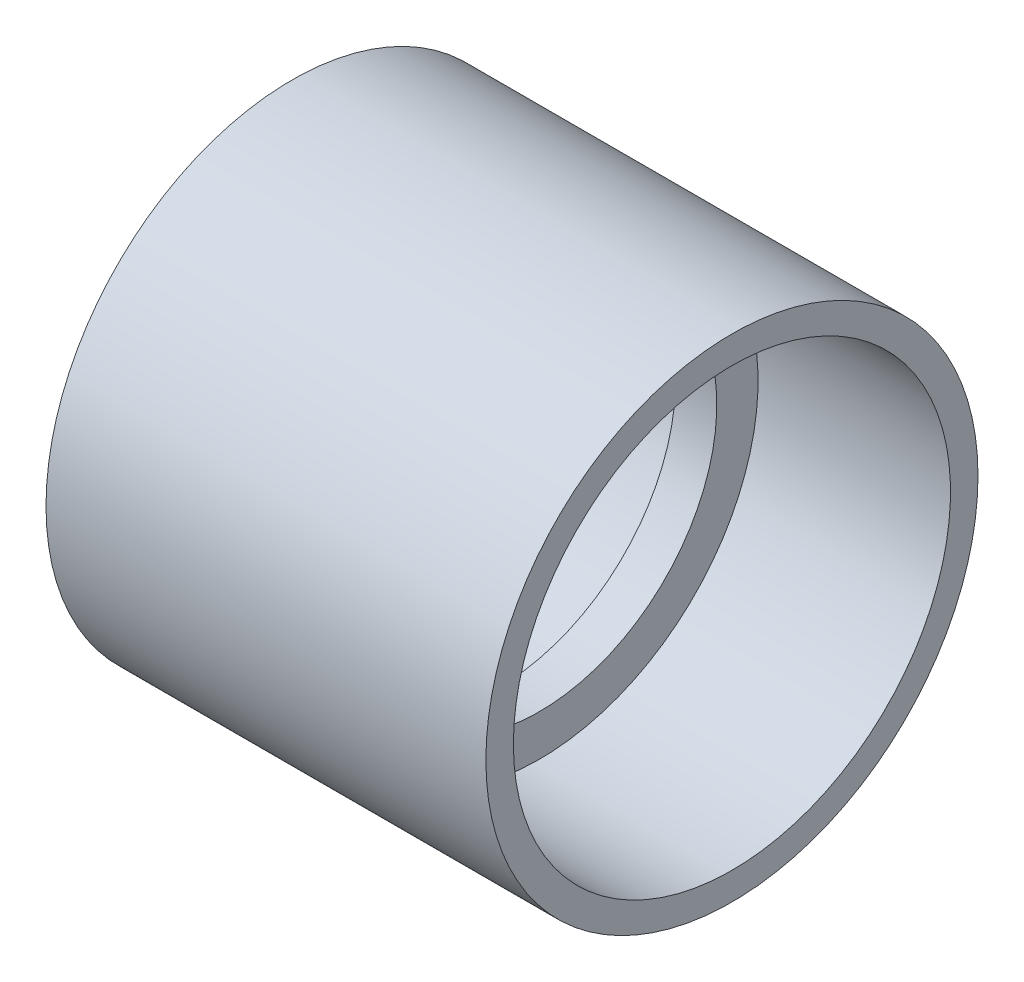
from build123d import *


with BuildPart() as part:
    # Sketch1 → Revolve1 (revolve)
    with BuildSketch(Plane(origin=(0, 0, 0), x_dir=(1, 0, 0), z_dir=(0, 1, 0)), mode=Mode.PRIVATE) as revolve1_sk:
        Polygon((3, 15.9), (17, 15.9), (17, 17.9), (-15, 17.9), (-15, 15.9), (0, 15.9), (0, 12.9), (3, 12.9), align=None)
    revolve(revolve1_sk.sketch.rotate(Axis((-15, 0, 0), (1, 0, 0)), 180), axis=Axis((-15, 0, 0), (1, 0, 0)))


solid = part.part
